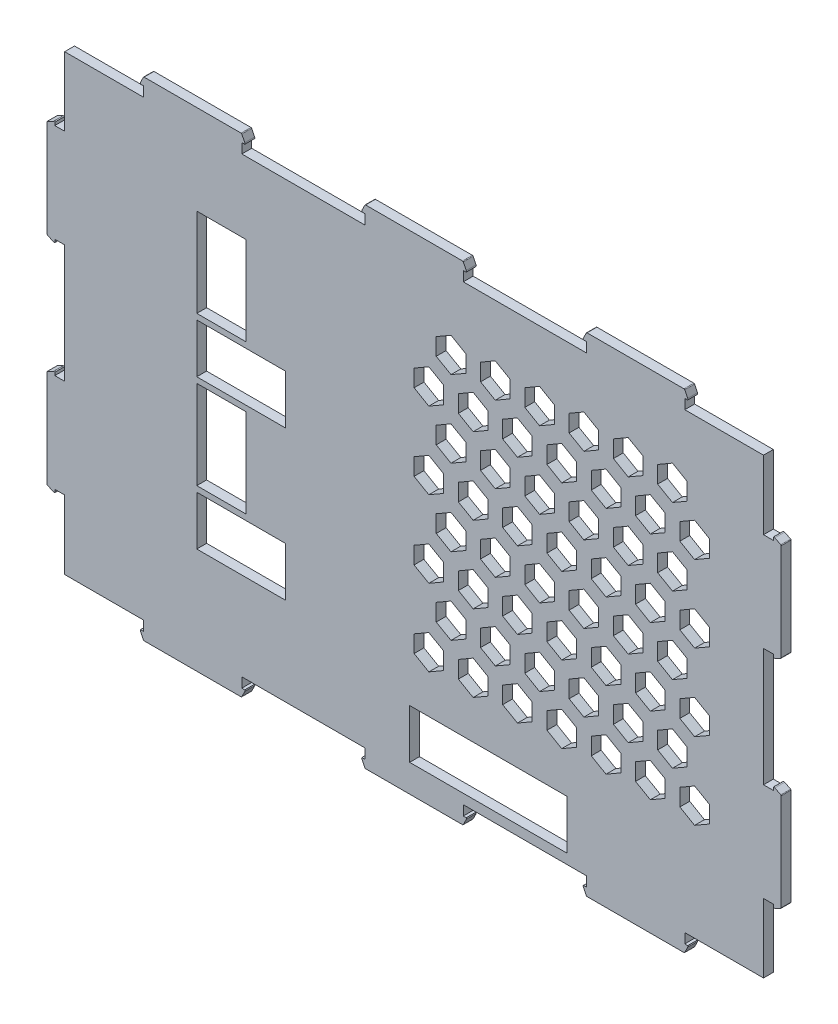
from build123d import *

# Parameters (mm, degrees)
SKETCH1_W               = 18
SKETCH1_H               = 10
SKETCH1_W_2             = 10
SKETCH1_H_2             = 18
SKETCH1_W_3             = 32
BOSS_EXTRUDE1_DEPTH     = 2
ENL_V_MAT_EXTRU_1_DEPTH = 154.829516023


with BuildPart() as part:
    # Sketch1 → Boss-Extrude1 (new body)
    with BuildSketch(Plane.XY):
        with BuildLine():
            Line((0, 32), (0, 46))
            Line((0, 46), (16, 46))
            Line((16, 46), (16, 48))
            Line((16, 48), (15.4, 48))
            ThreePointArc((15.4, 48), (15.364589803, 48.15), (15.4, 48.3))
            Line((15.4, 48.3), (16, 49.5))
            ThreePointArc((16, 49.5), (16.066697747, 49.572982477), (16.161803399, 49.6))
            Line((16.161803399, 49.6), (35.838196601, 49.6))
            ThreePointArc((35.838196601, 49.6), (35.933302253, 49.572982477), (36, 49.5))
            Line((36, 49.5), (36.6, 48.3))
            ThreePointArc((36.6, 48.3), (36.635410197, 48.15), (36.6, 48))
            Line((36.6, 48), (36, 48))
            Line((36, 48), (36, 46))
            Line((36, 46), (61, 46))
            Line((61, 46), (61, 48))
            Line((61, 48), (60.4, 48))
            ThreePointArc((60.4, 48), (60.364589803, 48.15), (60.4, 48.3))
            Line((60.4, 48.3), (61, 49.5))
            ThreePointArc((61, 49.5), (61.066697747, 49.572982477), (61.161803399, 49.6))
            Line((61.161803399, 49.6), (80.838196601, 49.6))
            ThreePointArc((80.838196601, 49.6), (80.933302253, 49.572982477), (81, 49.5))
            Line((81, 49.5), (81.6, 48.3))
            ThreePointArc((81.6, 48.3), (81.635410197, 48.15), (81.6, 48))
            Line((81.6, 48), (81, 48))
            Line((81, 48), (81, 46))
            Line((81, 46), (106, 46))
            Line((106, 46), (106, 48))
            Line((106, 48), (105.4, 48))
            ThreePointArc((105.4, 48), (105.364589803, 48.15), (105.4, 48.3))
            Line((105.4, 48.3), (106, 49.5))
            ThreePointArc((106, 49.5), (106.066697747, 49.572982477), (106.161803399, 49.6))
            Line((106.161803399, 49.6), (125.838196601, 49.6))
            ThreePointArc((125.838196601, 49.6), (125.933302253, 49.572982477), (126, 49.5))
            Line((126, 49.5), (126.6, 48.3))
            ThreePointArc((126.6, 48.3), (126.635410197, 48.15), (126.6, 48))
            Line((126.6, 48), (126, 48))
            Line((126, 48), (126, 46))
            Line((126, 46), (142, 46))
            Line((142, 46), (142, 32))
            Line((142, 32), (144, 32))
            Line((144, 32), (144, 32.6))
            ThreePointArc((144, 32.6), (144.15, 32.635410197), (144.3, 32.6))
            Line((144.3, 32.6), (145.5, 32))
            ThreePointArc((145.5, 32), (145.572982477, 31.933302253), (145.6, 31.838196601))
            Line((145.6, 31.838196601), (145.6, 12.161803399))
            ThreePointArc((145.6, 12.161803399), (145.572982477, 12.066697747), (145.5, 12))
            Line((145.5, 12), (144.3, 11.4))
            ThreePointArc((144.3, 11.4), (144.15, 11.364589803), (144, 11.4))
            Line((144, 11.4), (144, 12))
            Line((144, 12), (142, 12))
            Line((142, 12), (142, -12))
            Line((142, -12), (144, -12))
            Line((144, -12), (144, -11.4))
            ThreePointArc((144, -11.4), (144.15, -11.364589803), (144.3, -11.4))
            Line((144.3, -11.4), (145.5, -12))
            ThreePointArc((145.5, -12), (145.572982477, -12.066697747), (145.6, -12.161803399))
            Line((145.6, -12.161803399), (145.6, -31.838196601))
            ThreePointArc((145.6, -31.838196601), (145.572982477, -31.933302253), (145.5, -32))
            Line((145.5, -32), (144.3, -32.6))
            ThreePointArc((144.3, -32.6), (144.15, -32.635410197), (144, -32.6))
            Line((144, -32.6), (144, -32))
            Line((144, -32), (142, -32))
            Line((142, -32), (142, -46))
            Line((142, -46), (126, -46))
            Line((126, -46), (126, -48))
            Line((126, -48), (126.6, -48))
            ThreePointArc((126.6, -48), (126.635410197, -48.15), (126.6, -48.3))
            Line((126.6, -48.3), (126, -49.5))
            ThreePointArc((126, -49.5), (125.933302253, -49.572982477), (125.838196601, -49.6))
            Line((125.838196601, -49.6), (106.161803399, -49.6))
            ThreePointArc((106.161803399, -49.6), (106.066697747, -49.572982477), (106, -49.5))
            Line((106, -49.5), (105.4, -48.3))
            ThreePointArc((105.4, -48.3), (105.364589803, -48.15), (105.4, -48))
            Line((105.4, -48), (106, -48))
            Line((106, -48), (106, -46))
            Line((106, -46), (81, -46))
            Line((81, -46), (81, -48))
            Line((81, -48), (81.6, -48))
            ThreePointArc((81.6, -48), (81.635410197, -48.15), (81.6, -48.3))
            Line((81.6, -48.3), (81, -49.5))
            ThreePointArc((81, -49.5), (80.933302253, -49.572982477), (80.838196601, -49.6))
            Line((80.838196601, -49.6), (61.161803399, -49.6))
            ThreePointArc((61.161803399, -49.6), (61.066697747, -49.572982477), (61, -49.5))
            Line((61, -49.5), (60.4, -48.3))
            ThreePointArc((60.4, -48.3), (60.364589803, -48.15), (60.4, -48))
            Line((60.4, -48), (61, -48))
            Line((61, -48), (61, -46))
            Line((61, -46), (36, -46))
            Line((36, -46), (36, -48))
            Line((36, -48), (36.6, -48))
            ThreePointArc((36.6, -48), (36.635410197, -48.15), (36.6, -48.3))
            Line((36.6, -48.3), (36, -49.5))
            ThreePointArc((36, -49.5), (35.933302253, -49.572982477), (35.838196601, -49.6))
            Line((35.838196601, -49.6), (16.161803399, -49.6))
            ThreePointArc((16.161803399, -49.6), (16.066697747, -49.572982477), (16, -49.5))
            Line((16, -49.5), (15.4, -48.3))
            ThreePointArc((15.4, -48.3), (15.364589803, -48.15), (15.4, -48))
            Line((15.4, -48), (16, -48))
            Line((16, -48), (16, -46))
            Line((16, -46), (0, -46))
            Line((0, -46), (0, -32))
            Line((0, -32), (-2, -32))
            Line((-2, -32), (-2, -32.6))
            ThreePointArc((-2, -32.6), (-2.15, -32.635410197), (-2.3, -32.6))
            Line((-2.3, -32.6), (-3.5, -32))
            ThreePointArc((-3.5, -32), (-3.572982477, -31.933302253), (-3.6, -31.838196601))
            Line((-3.6, -31.838196601), (-3.6, -12.161803399))
            ThreePointArc((-3.6, -12.161803399), (-3.572982477, -12.066697747), (-3.5, -12))
            Line((-3.5, -12), (-2.3, -11.4))
            ThreePointArc((-2.3, -11.4), (-2.15, -11.364589803), (-2, -11.4))
            Line((-2, -11.4), (-2, -12))
            Line((-2, -12), (0, -12))
            Line((0, -12), (0, 12))
            Line((0, 12), (-2, 12))
            Line((-2, 12), (-2, 11.4))
            ThreePointArc((-2, 11.4), (-2.15, 11.364589803), (-2.3, 11.4))
            Line((-2.3, 11.4), (-3.5, 12))
            ThreePointArc((-3.5, 12), (-3.572982477, 12.066697747), (-3.6, 12.161803399))
            Line((-3.6, 12.161803399), (-3.6, 31.838196601))
            ThreePointArc((-3.6, 31.838196601), (-3.572982477, 31.933302253), (-3.5, 32))
            Line((-3.5, 32), (-2.3, 32.6))
            ThreePointArc((-2.3, 32.6), (-2.15, 32.635410197), (-2, 32.6))
            Line((-2, 32.6), (-2, 32))
            Line((-2, 32), (0, 32))
        make_face()
        with Locations((35.845845199, 7.219642727)):
            Rectangle(SKETCH1_W, SKETCH1_H, mode=Mode.SUBTRACT)
        with Locations((35.845845199, -23.091893528)):
            Rectangle(SKETCH1_W, SKETCH1_H, mode=Mode.SUBTRACT)
        with Locations((31.845845199, -7.9361254)):
            Rectangle(SKETCH1_W_2, SKETCH1_H_2, mode=Mode.SUBTRACT)
        with Locations((31.845845199, 22.375410855)):
            Rectangle(SKETCH1_W_2, SKETCH1_H_2, mode=Mode.SUBTRACT)
        with Locations((86.1, -39)):
            Rectangle(SKETCH1_W_3, SKETCH1_H, mode=Mode.SUBTRACT)
    extrude(amount=BOSS_EXTRUDE1_DEPTH)

    # Esquisse1 → Enlèv. mat.-Extru.1 (cut, through all)
    with BuildSketch(Plane.XY.offset(2)):
        Polygon((131, 10.235965948), (128, 11.968016755), (125, 10.235965948), (125, 6.771864332), (128, 5.039813525), (131, 6.771864332), align=None)
        Polygon((120.5, 14.566092966), (123.5, 12.834042159), (126.5, 14.566092966), (126.5, 18.030194582), (123.5, 19.762245389), (120.5, 18.030194582), align=None)
        Polygon((122, 6.771864332), (122, 10.235965948), (119, 11.968016755), (116, 10.235965948), (116, 6.771864332), (119, 5.039813525), align=None)
        Polygon((111.5, 14.566092966), (114.5, 12.834042159), (117.5, 14.566092966), (117.5, 18.030194582), (114.5, 19.762245389), (111.5, 18.030194582), align=None)
        Polygon((107, 6.771864332), (110, 5.039813525), (113, 6.771864332), (113, 10.235965948), (110, 11.968016755), (107, 10.235965948), align=None)
        Polygon((102.5, 14.566092966), (105.5, 12.834042159), (108.5, 14.566092966), (108.5, 18.030194582), (105.5, 19.762245389), (102.5, 18.030194582), align=None)
        Polygon((98, 6.771864332), (101, 5.039813525), (104, 6.771864332), (104, 10.235965948), (101, 11.968016755), (98, 10.235965948), align=None)
        Polygon((95, 6.771864332), (95, 10.235965948), (92, 11.968016755), (89, 10.235965948), (89, 6.771864332), (92, 5.039813525), align=None)
        Polygon((84.5, 14.566092966), (87.5, 12.834042159), (90.5, 14.566092966), (90.5, 18.030194582), (87.5, 19.762245389), (84.5, 18.030194582), align=None)
        Polygon((80, 6.771864332), (83, 5.039813525), (86, 6.771864332), (86, 10.235965948), (83, 11.968016755), (80, 10.235965948), align=None)
        Polygon((75.5, 14.566092966), (78.5, 12.834042159), (81.5, 14.566092966), (81.5, 18.030194582), (78.5, 19.762245389), (75.5, 18.030194582), align=None)
        Polygon((71, 6.771864332), (74, 5.039813525), (77, 6.771864332), (77, 10.235965948), (74, 11.968016755), (71, 10.235965948), align=None)
        Polygon((99.5, 18.030194582), (96.5, 19.762245389), (93.5, 18.030194582), (93.5, 14.566092966), (96.5, 12.834042159), (99.5, 14.566092966), align=None)
        Polygon((131, 25.824423216), (128, 27.556474023), (125, 25.824423216), (125, 22.360321601), (128, 20.628270793), (131, 22.360321601), align=None)
        Polygon((120.5, 30.154550235), (123.5, 28.422499427), (126.5, 30.154550235), (126.5, 33.61865185), (123.5, 35.350702657), (120.5, 33.61865185), align=None)
        Polygon((122, 22.360321601), (122, 25.824423216), (119, 27.556474023), (116, 25.824423216), (116, 22.360321601), (119, 20.628270793), align=None)
        Polygon((111.5, 30.154550235), (114.5, 28.422499427), (117.5, 30.154550235), (117.5, 33.61865185), (114.5, 35.350702657), (111.5, 33.61865185), align=None)
        Polygon((107, 22.360321601), (110, 20.628270793), (113, 22.360321601), (113, 25.824423216), (110, 27.556474023), (107, 25.824423216), align=None)
        Polygon((102.5, 30.154550235), (105.5, 28.422499427), (108.5, 30.154550235), (108.5, 33.61865185), (105.5, 35.350702657), (102.5, 33.61865185), align=None)
        Polygon((98, 22.360321601), (101, 20.628270793), (104, 22.360321601), (104, 25.824423216), (101, 27.556474023), (98, 25.824423216), align=None)
        Polygon((95, 22.360321601), (95, 25.824423216), (92, 27.556474023), (89, 25.824423216), (89, 22.360321601), (92, 20.628270793), align=None)
        Polygon((84.5, 30.154550235), (87.5, 28.422499427), (90.5, 30.154550235), (90.5, 33.61865185), (87.5, 35.350702657), (84.5, 33.61865185), align=None)
        Polygon((80, 22.360321601), (83, 20.628270793), (86, 22.360321601), (86, 25.824423216), (83, 27.556474023), (80, 25.824423216), align=None)
        Polygon((75.5, 30.154550235), (78.5, 28.422499427), (81.5, 30.154550235), (81.5, 33.61865185), (78.5, 35.350702657), (75.5, 33.61865185), align=None)
        Polygon((71, 22.360321601), (74, 20.628270793), (77, 22.360321601), (77, 25.824423216), (74, 27.556474023), (71, 25.824423216), align=None)
        Polygon((99.5, 33.61865185), (96.5, 35.350702657), (93.5, 33.61865185), (93.5, 30.154550235), (96.5, 28.422499427), (99.5, 30.154550235), align=None)
        Polygon((131, -20.940948589), (128, -19.208897781), (125, -20.940948589), (125, -24.405050204), (128, -26.137101011), (131, -24.405050204), align=None)
        Polygon((120.5, -16.61082157), (123.5, -18.342872377), (126.5, -16.61082157), (126.5, -13.146719955), (123.5, -11.414669147), (120.5, -13.146719955), align=None)
        Polygon((122, -24.405050204), (122, -20.940948589), (119, -19.208897781), (116, -20.940948589), (116, -24.405050204), (119, -26.137101011), align=None)
        Polygon((111.5, -16.61082157), (114.5, -18.342872377), (117.5, -16.61082157), (117.5, -13.146719955), (114.5, -11.414669147), (111.5, -13.146719955), align=None)
        Polygon((107, -24.405050204), (110, -26.137101011), (113, -24.405050204), (113, -20.940948589), (110, -19.208897781), (107, -20.940948589), align=None)
        Polygon((102.5, -16.61082157), (105.5, -18.342872377), (108.5, -16.61082157), (108.5, -13.146719955), (105.5, -11.414669147), (102.5, -13.146719955), align=None)
        Polygon((98, -24.405050204), (101, -26.137101011), (104, -24.405050204), (104, -20.940948589), (101, -19.208897781), (98, -20.940948589), align=None)
        Polygon((95, -24.405050204), (95, -20.940948589), (92, -19.208897781), (89, -20.940948589), (89, -24.405050204), (92, -26.137101011), align=None)
        Polygon((84.5, -16.61082157), (87.5, -18.342872377), (90.5, -16.61082157), (90.5, -13.146719955), (87.5, -11.414669147), (84.5, -13.146719955), align=None)
        Polygon((80, -24.405050204), (83, -26.137101011), (86, -24.405050204), (86, -20.940948589), (83, -19.208897781), (80, -20.940948589), align=None)
        Polygon((75.5, -16.61082157), (78.5, -18.342872377), (81.5, -16.61082157), (81.5, -13.146719955), (78.5, -11.414669147), (75.5, -13.146719955), align=None)
        Polygon((71, -24.405050204), (74, -26.137101011), (77, -24.405050204), (77, -20.940948589), (74, -19.208897781), (71, -20.940948589), align=None)
        Polygon((99.5, -13.146719955), (96.5, -11.414669147), (93.5, -13.146719955), (93.5, -16.61082157), (96.5, -18.342872377), (99.5, -16.61082157), align=None)
        Polygon((131, -5.352491321), (128, -3.620440513), (125, -5.352491321), (125, -8.816592936), (128, -10.548643743), (131, -8.816592936), align=None)
        Polygon((120.5, -1.022364302), (123.5, -2.754415109), (126.5, -1.022364302), (126.5, 2.441737313), (123.5, 4.173788121), (120.5, 2.441737313), align=None)
        Polygon((122, -8.816592936), (122, -5.352491321), (119, -3.620440513), (116, -5.352491321), (116, -8.816592936), (119, -10.548643743), align=None)
        Polygon((111.5, -1.022364302), (114.5, -2.754415109), (117.5, -1.022364302), (117.5, 2.441737313), (114.5, 4.173788121), (111.5, 2.441737313), align=None)
        Polygon((107, -8.816592936), (110, -10.548643743), (113, -8.816592936), (113, -5.352491321), (110, -3.620440513), (107, -5.352491321), align=None)
        Polygon((102.5, -1.022364302), (105.5, -2.754415109), (108.5, -1.022364302), (108.5, 2.441737313), (105.5, 4.173788121), (102.5, 2.441737313), align=None)
        Polygon((98, -8.816592936), (101, -10.548643743), (104, -8.816592936), (104, -5.352491321), (101, -3.620440513), (98, -5.352491321), align=None)
        Polygon((95, -8.816592936), (95, -5.352491321), (92, -3.620440513), (89, -5.352491321), (89, -8.816592936), (92, -10.548643743), align=None)
        Polygon((84.5, -1.022364302), (87.5, -2.754415109), (90.5, -1.022364302), (90.5, 2.441737313), (87.5, 4.173788121), (84.5, 2.441737313), align=None)
        Polygon((80, -8.816592936), (83, -10.548643743), (86, -8.816592936), (86, -5.352491321), (83, -3.620440513), (80, -5.352491321), align=None)
        Polygon((75.5, -1.022364302), (78.5, -2.754415109), (81.5, -1.022364302), (81.5, 2.441737313), (78.5, 4.173788121), (75.5, 2.441737313), align=None)
        Polygon((71, -8.816592936), (74, -10.548643743), (77, -8.816592936), (77, -5.352491321), (74, -3.620440513), (71, -5.352491321), align=None)
        Polygon((99.5, 2.441737313), (96.5, 4.173788121), (93.5, 2.441737313), (93.5, -1.022364302), (96.5, -2.754415109), (99.5, -1.022364302), align=None)
    extrude(amount=-ENL_V_MAT_EXTRU_1_DEPTH, mode=Mode.SUBTRACT)


solid = part.part
